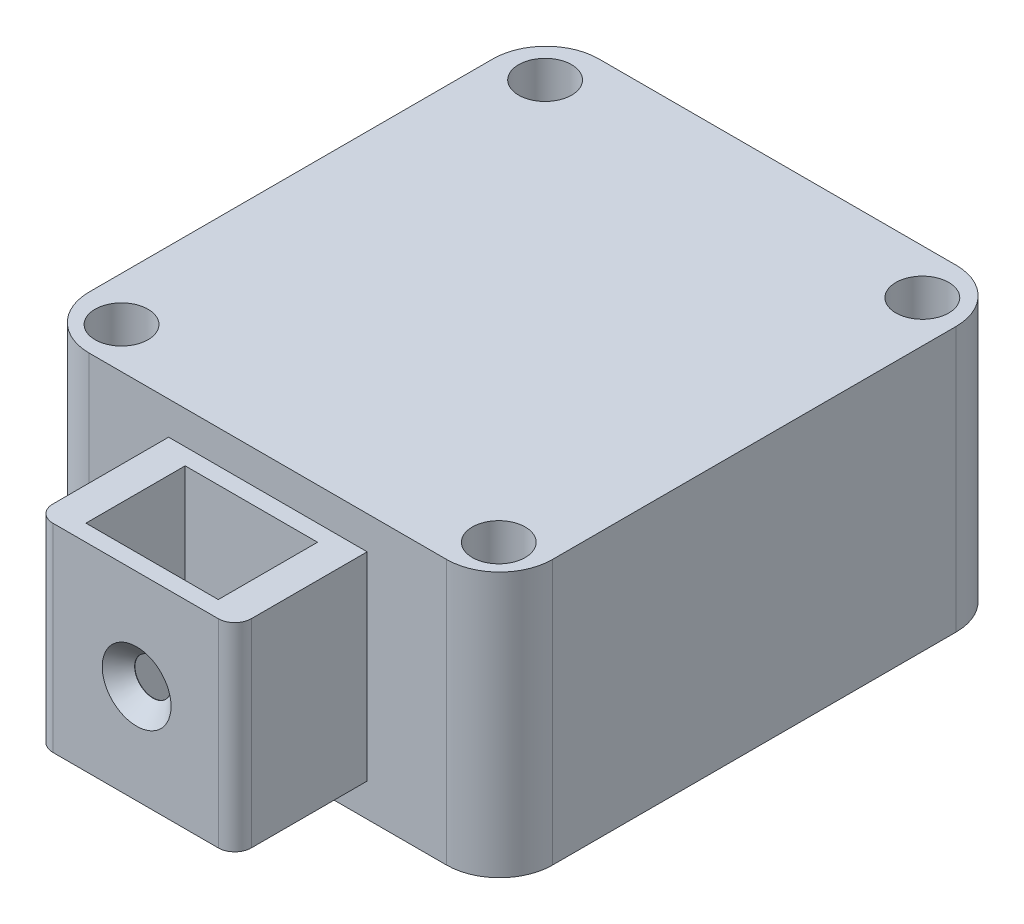
from build123d import *

# Parameters (mm, degrees)
SKETCH4_W                                           = 70
SKETCH4_H                                           = 77
BOSS_EXTRUDE1_DEPTH                                 = 40
SKETCH5_R                                           = 4
CUT_EXTRUDE1_DEPTH                                  = 30
SKETCH6_W                                           = 30
SKETCH6_H                                           = 30
BOSS_EXTRUDE3_DEPTH                                 = 20
SKETCH7_W                                           = 20
SKETCH7_H                                           = 15
CUT_EXTRUDE2_DEPTH                                  = 30
CSK_FOR_M5_COUNTERSUNK_FLAT_HEAD_SCREW1_D           = 5.5
CSK_FOR_M5_COUNTERSUNK_FLAT_HEAD_SCREW1_DEPTH       = 30
CSK_FOR_M5_COUNTERSUNK_FLAT_HEAD_SCREW1_CSINK_D     = 10.4
CSK_FOR_M5_COUNTERSUNK_FLAT_HEAD_SCREW1_CSINK_ANGLE = 90
CSK_FOR_M5_COUNTERSUNK_FLAT_HEAD_SCREW1_TIP         = 1.652366702
FILLET1_R                                           = 8
FILLET2_R                                           = 2.5


with BuildPart() as part:
    # Sketch4 → Boss-Extrude1 (new body)
    with BuildSketch(Plane(origin=(0, 0, 0), x_dir=(1, 0, 0), z_dir=(0, 1, 0))):
        with Locations((-0.193370166, 0.309392265)):
            Rectangle(SKETCH4_W, SKETCH4_H)
    extrude(amount=BOSS_EXTRUDE1_DEPTH)

    # Sketch5 → Cut-Extrude1 (cut)
    with BuildSketch(Plane(origin=(0, 40, 0), x_dir=(1, 0, 0), z_dir=(0, 1, 0))):
        with Locations(Location((-28.5, 32, 0), (0, 0, 270))):
            Circle(SKETCH5_R)
        with Locations(Location((28.5, 32, 0), (0, 0, 270))):
            Circle(SKETCH5_R)
        with Locations(Location((-28.5, -32, 0), (0, 0, 270))):
            Circle(SKETCH5_R)
        with Locations(Location((28.5, -32, 0), (0, 0, 270))):
            Circle(SKETCH5_R)
    extrude(amount=-CUT_EXTRUDE1_DEPTH, mode=Mode.SUBTRACT)

    # Sketch6 → Boss-Extrude3 (add)
    with BuildSketch(Plane.XY.offset(38.190607735)):
        with Locations((-0.193370166, 20)):
            Rectangle(SKETCH6_W, SKETCH6_H)
    extrude(amount=BOSS_EXTRUDE3_DEPTH)

    # Sketch7 → Cut-Extrude2 (cut)
    with BuildSketch(Plane(origin=(0, 35, 0), x_dir=(1, 0, 0), z_dir=(0, 1, 0))):
        with Locations((-0.193370166, -48.190607735)):
            Rectangle(SKETCH7_W, SKETCH7_H)
    extrude(amount=-CUT_EXTRUDE2_DEPTH, mode=Mode.SUBTRACT)

    # CSK for M5 Countersunk Flat Head Screw1
    with Locations(Plane.XY.offset(58.190607735)):
        with Locations((-0.028758017, 19.958846963)):
            CounterSinkHole(CSK_FOR_M5_COUNTERSUNK_FLAT_HEAD_SCREW1_D / 2, CSK_FOR_M5_COUNTERSUNK_FLAT_HEAD_SCREW1_CSINK_D / 2, depth=CSK_FOR_M5_COUNTERSUNK_FLAT_HEAD_SCREW1_DEPTH, counter_sink_angle=CSK_FOR_M5_COUNTERSUNK_FLAT_HEAD_SCREW1_CSINK_ANGLE)
            with Locations((0, 0, -(CSK_FOR_M5_COUNTERSUNK_FLAT_HEAD_SCREW1_DEPTH + CSK_FOR_M5_COUNTERSUNK_FLAT_HEAD_SCREW1_TIP / 2))):  # 118° drill point
                Cone(0, CSK_FOR_M5_COUNTERSUNK_FLAT_HEAD_SCREW1_D / 2, CSK_FOR_M5_COUNTERSUNK_FLAT_HEAD_SCREW1_TIP, mode=Mode.SUBTRACT)

    # Fillet1
    fillet1_edges = [part.edges().sort_by_distance(p)[0] for p in [
        (34.806629834, 20, 38.190607735),
        (-35.193370166, 20, 38.190607735),
        (-35.193370166, 20, -38.809392265),
        (34.806629834, 20, -38.809392265),
    ]]
    fillet(fillet1_edges, radius=FILLET1_R)

    # Fillet2
    fillet2_edges = [part.edges().sort_by_distance(p)[0] for p in [
        (-15.193370166, 20, 58.190607735),
        (14.806629834, 20, 58.190607735),
    ]]
    fillet(fillet2_edges, radius=FILLET2_R)


solid = part.part
